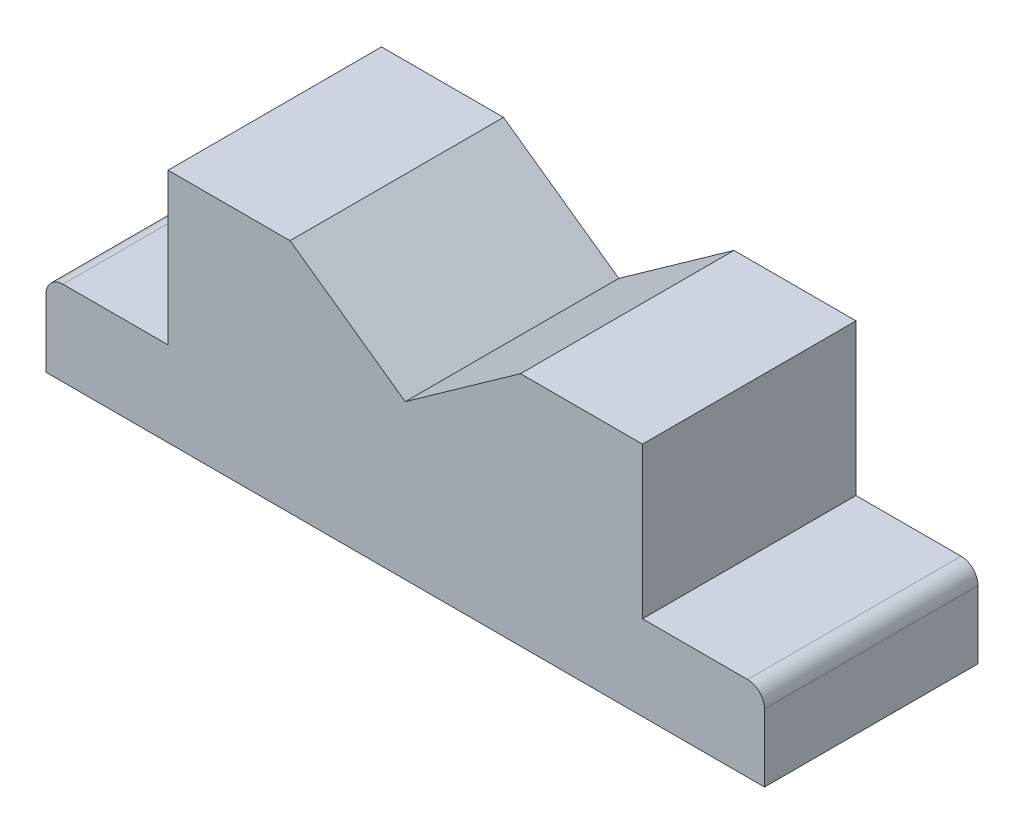
from build123d import *

# Parameters (mm, degrees)
BOSS_EXTRUDE1_DEPTH = 63
FILLET1_R           = 5
FILLET2_R           = 5


with BuildPart() as part:
    # Sketch1 → Boss-Extrude1 (new body)
    with BuildSketch(Plane.XY):
        Polygon((0, 0), (212, 0), (212, 25), (176, 25), (176, 69.632533644), (140, 69.632533644), (106.004578334, 45.485327779), (72.004578334, 69.632533644), (36.004578334, 69.632533644), (36.004578334, 25), (0, 25), align=None)
    extrude(amount=BOSS_EXTRUDE1_DEPTH)

    # Fillet1
    fillet1_edges = [part.edges().sort_by_distance(p)[0] for p in [
        (212, 25, 31.5),
    ]]
    fillet(fillet1_edges, radius=FILLET1_R)

    # Fillet2
    fillet2_edges = [part.edges().sort_by_distance(p)[0] for p in [
        (0, 25, 31.5),
    ]]
    fillet(fillet2_edges, radius=FILLET2_R)


solid = part.part
